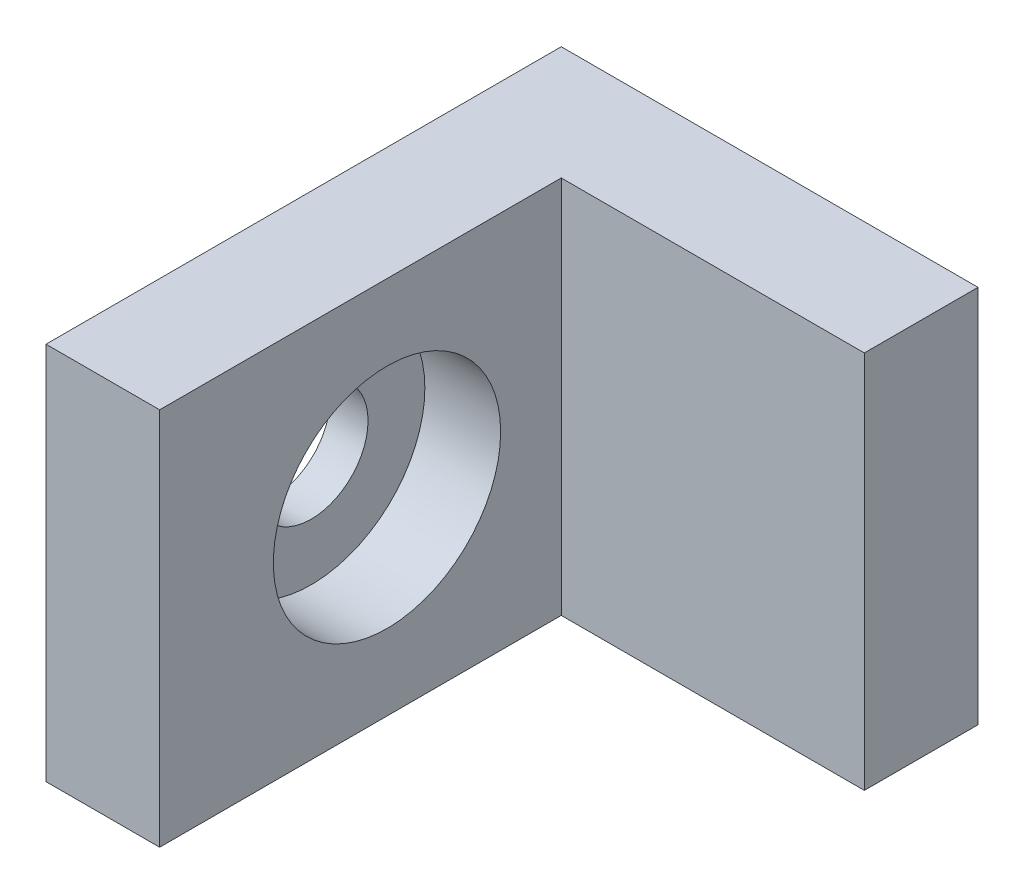
from build123d import *

# Parameters (mm, degrees)
SKETCH_1_W          = 16
SKETCH_1_H          = 10
EXTRUDE_1_DEPTH     = 3
SKETCH_2_W          = 3
SKETCH_2_H          = 10
EXTRUDE_2_DEPTH     = 8
SKETCH_3_R          = 1.5
CUT_EXTRUDE_1_DEPTH = 3
SKETCH_5_R          = 3
CUT_EXTRUDE_3_DEPTH = 2
SKETCH_7_W          = 0.4
SKETCH_7_H          = 10
CUT_EXTRUDE_4_DEPTH = 22
SKETCH_8_R          = 2.1
CUT_EXTRUDE_5_DEPTH = 4.2
SKETCH_9_W          = 8
SKETCH_9_H          = 10
EXTRUDE_3_DEPTH     = 2
SKETCH_10_W         = 11
SKETCH_10_H         = 10
CUT_EXTRUDE_6_DEPTH = 2
FILLET_1_R          = 0.4


with BuildPart() as part:
    # 草图1 → 凸台-拉伸1 (new body)
    with BuildSketch(Plane(origin=(0, 0, 0), x_dir=(0, 0, -1), z_dir=(1, 0, 0))):
        with Locations((-8, 5)):
            Rectangle(SKETCH_1_W, SKETCH_1_H)
    extrude(amount=EXTRUDE_1_DEPTH)

    # 草图2 → 凸台-拉伸2 (add)
    with BuildSketch(Plane(origin=(3, 0, 0), x_dir=(0, 0, -1), z_dir=(1, 0, 0))):
        with Locations((-1.9, 5)):
            Rectangle(SKETCH_2_W, SKETCH_2_H)
    extrude(amount=EXTRUDE_2_DEPTH)

    # 草图3 → 切除-拉伸1 (cut)
    with BuildSketch(Plane(origin=(3, 0, 0), x_dir=(0, 0, -1), z_dir=(1, 0, 0))):
        with Locations((-10, 5)):
            Circle(SKETCH_3_R)
    extrude(amount=-CUT_EXTRUDE_1_DEPTH, mode=Mode.SUBTRACT)

    # 草图5 → 切除-拉伸3 (cut)
    with BuildSketch(Plane(origin=(3, 0, 0), x_dir=(0, 0, -1), z_dir=(1, 0, 0))):
        with Locations((-10, 5)):
            Circle(SKETCH_5_R)
    extrude(amount=-CUT_EXTRUDE_3_DEPTH, mode=Mode.SUBTRACT)

    # 草图7 → 切除-拉伸4 (cut)
    with BuildSketch(Plane(origin=(3, 0, 0), x_dir=(0, 0, -1), z_dir=(1, 0, 0))):
        with Locations((-0.2, 5)):
            Rectangle(SKETCH_7_W, SKETCH_7_H)
    extrude(amount=-CUT_EXTRUDE_4_DEPTH, mode=Mode.SUBTRACT)

    # 草图8 → 切除-拉伸5 (cut)
    with BuildSketch(Plane(origin=(0, 0, 0.4), x_dir=(-1, 0, 0), z_dir=(0, 0, -1))):
        with Locations(Location((-7.8, 5, 0), (0, 0, 90))):
            Circle(SKETCH_8_R)
    extrude(amount=-CUT_EXTRUDE_5_DEPTH, mode=Mode.SUBTRACT)

    # 草图9 → 凸台-拉伸3 (add)
    with BuildSketch(Plane.XY.offset(3.4)):
        with Locations((7, 5)):
            Rectangle(SKETCH_9_W, SKETCH_9_H)
    extrude(amount=EXTRUDE_3_DEPTH)

    # 草图10 → 切除-拉伸6 (cut)
    with BuildSketch(Plane(origin=(0, 0, 0.4), x_dir=(-1, 0, 0), z_dir=(0, 0, -1))):
        with Locations((-5.5, 5)):
            Rectangle(SKETCH_10_W, SKETCH_10_H)
    extrude(amount=-CUT_EXTRUDE_6_DEPTH, mode=Mode.SUBTRACT)

    # 圆角1
    fillet_1_edges = [part.edges().sort_by_distance(p)[0] for p in [
        (7.8, 2.9, 2.4),
    ]]
    fillet(fillet_1_edges, radius=FILLET_1_R)


solid = part.part
